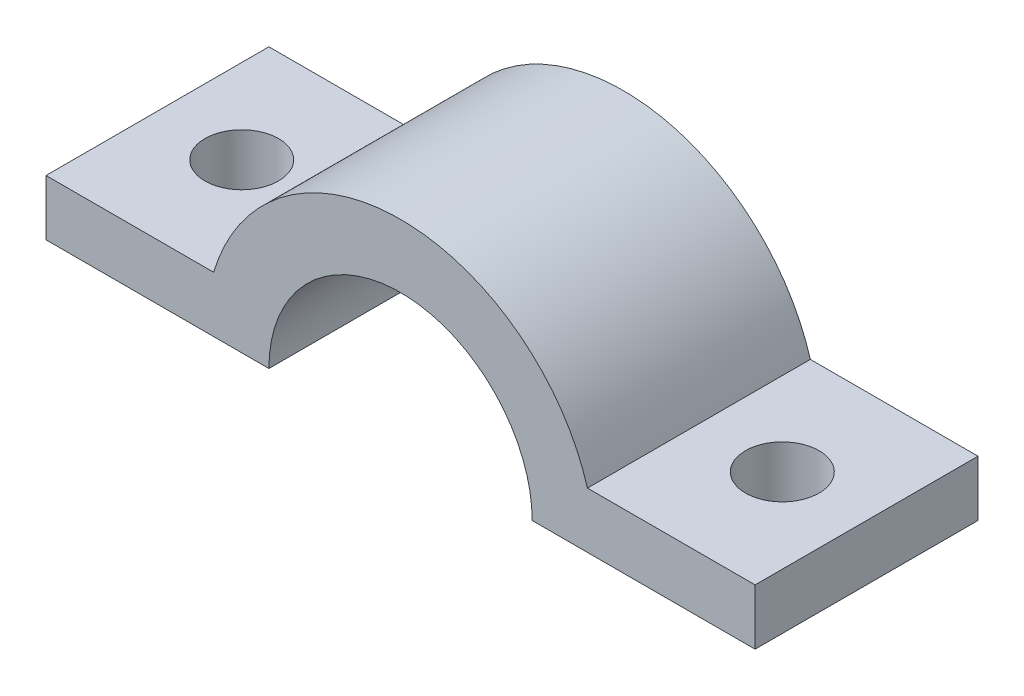
from build123d import *

# Parameters (mm, degrees)
BOSS_EXTRUDE1_DEPTH = 25.4
SKETCH2_R           = 4.191
CUT_EXTRUDE1_DEPTH  = 6.35


with BuildPart() as part:
    # Sketch1 → Boss-Extrude1 (new body)
    with BuildSketch(Plane.XY):
        with BuildLine():
            Line((-40.4, 0), (-15, 0))
            ThreePointArc((-15, 0), (0, 15), (15, 0))
            Line((15, 0), (40.4, 0))
            Line((40.4, 0), (40.4, 6.35))
            Line((40.4, 6.35), (21.298547486, 6.35))
            ThreePointArc((21.298547486, 6.35), (0, 22.225), (-21.298547486, 6.35))
            Line((-21.298547486, 6.35), (-40.4, 6.35))
            Line((-40.4, 6.35), (-40.4, 0))
        make_face()
    extrude(amount=BOSS_EXTRUDE1_DEPTH)

    # Sketch2 → Cut-Extrude1 (cut)
    with BuildSketch(Plane(origin=(0, 6.35, 0), x_dir=(1, 0, 0), z_dir=(0, 1, 0))):
        with Locations(Location((-30.798547486, -12.7, 0), (0, 0, 180))):
            Circle(SKETCH2_R)
        with Locations(Location((30.798553886, -12.7, 0), (0, 0, 180))):
            Circle(SKETCH2_R)
    extrude(amount=-CUT_EXTRUDE1_DEPTH, mode=Mode.SUBTRACT)


solid = part.part
